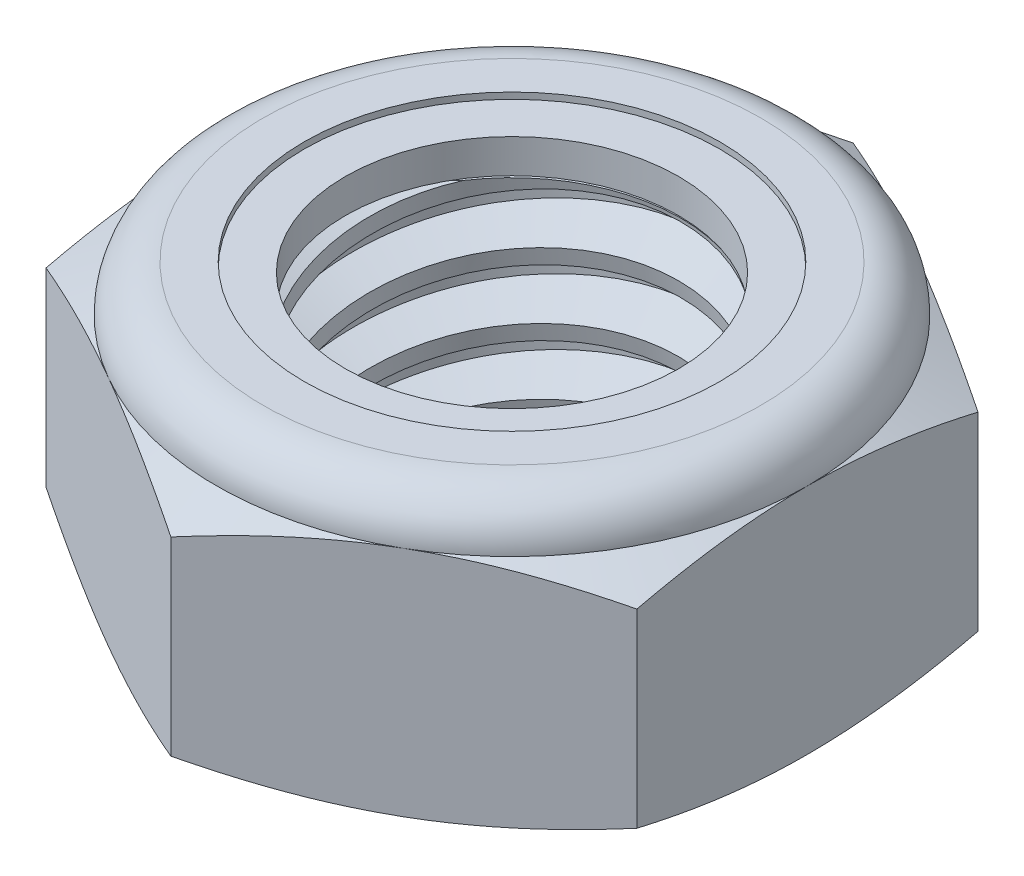
from build123d import *

# Parameters (mm, degrees)
EXTRUDE1_DEPTH       = 6.746875
SKETCH2_W            = 4.7625
SKETCH2_H            = 6.746875
LPATTERN1_COUNT      = 4
LPATTERN1_PITCH      = 1.5875
LPATTERN1_COUNT_DIR2 = 2
LPATTERN1_PITCH_DIR2 = 1.5875


with BuildPart() as part:
    # Sketch1 → Extrude1 (new body)
    with BuildSketch(Plane(origin=(0, 0, 0), x_dir=(1, 0, 0), z_dir=(0, 1, 0))):
        Polygon((0, 8.248891971), (-7.14375, 4.124445986), (-7.14375, -4.124445986), (0, -8.248891971), (7.14375, -4.124445986), (7.14375, 4.124445986), align=None)
    extrude(amount=EXTRUDE1_DEPTH)

    # Sketch4 → Cut-Revolve2 (revolve, cut)
    with BuildSketch(Plane(origin=(0, 0, 0), x_dir=(0, 0, -1), z_dir=(1, 0, 0))):
        Polygon((0, 6.746875), (4.7625, 6.746875), (4.029111805, 6.404890468), (4.029111805, 0.341984532), (4.7625, 0), (0, 0), align=None)
    revolve(axis=Axis((0, 6.746875, 0), (0, 1, 0)), mode=Mode.SUBTRACT)


with BuildPart() as body_2:
    # Sketch2 → Revolve1 (revolve)
    with BuildSketch(Plane(origin=(0, 0, 0), x_dir=(0, 0, -1), z_dir=(1, 0, 0))):
        with Locations((2.38125, 3.3734375)):
            Rectangle(SKETCH2_W, SKETCH2_H)
    revolve(axis=Axis((0, -4.7625, 0), (0, 1, 0)))

    # Sketch3 → Cut-Revolve1 (revolve, cut)
    with BuildSketch(Plane(origin=(0, 0, 0), x_dir=(0, 0, -1), z_dir=(1, 0, 0))):
        Polygon((4.795122924, 6.551137456), (5.023483392, 5.180974646), (4.094357653, 5.529057102), (4.029111805, 5.92053219), align=None)
    cut_revolve1 = revolve(axis=Axis((0, 6.746875, 0.28317269), (0, -0.9863939238321437, -0.16439898730535754)), mode=Mode.SUBTRACT)

    # LPattern1: Cut-Revolve1 4 × 2
    with Locations(*[Vector(0, -1, 0) * (i * LPATTERN1_PITCH) + Vector(0, 1, 0) * (j * LPATTERN1_PITCH_DIR2) for i in range(LPATTERN1_COUNT) for j in range(LPATTERN1_COUNT_DIR2) if (i, j) != (0, 0)]):
        add(cut_revolve1, mode=Mode.SUBTRACT)


with BuildPart() as part_1:
    add(part.part)

    # Combine1: cut body 2
    add(body_2.part, mode=Mode.SUBTRACT)

    # Sketch5 → Cut-Revolve3 (revolve, cut)
    with BuildSketch(Plane(origin=(0, 0, 0), x_dir=(0, 0, -1), z_dir=(1, 0, 0))):
        with BuildLine():
            Line((0, 0), (7.14375, 0))
            Line((7.14375, 0), (8.248891971, 0.515336164))
            Line((8.248891971, 0.515336164), (8.248891971, 5.107059669))
            Line((8.248891971, 5.107059669), (7.14375, 5.622395833))
            ThreePointArc((7.14375, 5.622395833), (6.814397677, 6.417522677), (6.019270833, 6.746875))
            Line((6.019270833, 6.746875), (6.019270833, 8.016875))
            Line((6.019270833, 8.016875), (9.518891971, 8.016875))
            Line((9.518891971, 8.016875), (9.518891971, -1.27))
            Line((9.518891971, -1.27), (0, -1.27))
            Line((0, -1.27), (0, 0))
        make_face()
    revolve(axis=Axis((0, 0, 0), (0, 1, 0)), mode=Mode.SUBTRACT)

    # Sketch6 → Cut-Revolve4 (revolve, cut)
    with BuildSketch(Plane(origin=(0, 0, 0), x_dir=(0, 0, -1), z_dir=(1, 0, 0))):
        with BuildLine():
            Line((0, 5.622395833), (6.99135, 5.622395833))
            ThreePointArc((6.99135, 5.622395833), (6.706634604, 6.309759604), (6.019270833, 6.594475))
            Line((6.019270833, 6.594475), (5.024191319, 6.594475))
            Line((5.024191319, 6.594475), (5.024191319, 8.016875))
            Line((5.024191319, 8.016875), (0, 8.016875))
            Line((0, 8.016875), (0, 5.622395833))
        make_face()
    revolve(axis=Axis((0, 8.016875, 0), (0, 1, 0)), mode=Mode.SUBTRACT)


with BuildPart() as body_2_2:
    # Sketch7 → Revolve2 (revolve)
    with BuildSketch(Plane(origin=(0, 0, 0), x_dir=(0, 0, -1), z_dir=(1, 0, 0))):
        with BuildLine():
            Line((4.029111805, 5.698595833), (6.91190348, 5.698595833))
            ThreePointArc((6.91190348, 5.698595833), (6.625213689, 6.282269107), (6.019270833, 6.518275))
            Line((6.019270833, 6.518275), (4.029111805, 6.518275))
            Line((4.029111805, 6.518275), (4.029111805, 5.698595833))
        make_face()
    revolve(axis=Axis((0, 5.698595833, 0), (0, 1, 0)))


solid = Compound([part_1.part, body_2_2.part])
